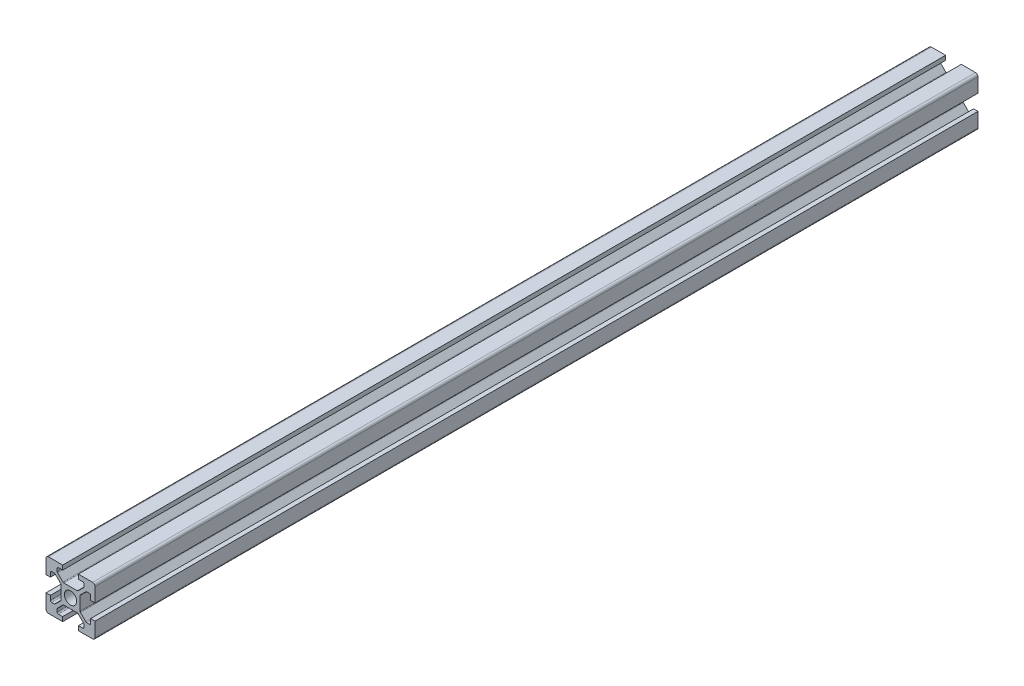
from build123d import *

# Parameters (mm, degrees)
SKETCH1_R           = 2.5
BOSS_EXTRUDE1_DEPTH = 360
FILLET1_R           = 1
FILLET2_R           = 0.5
FILLET3_R           = 0.5
FILLET4_R           = 0.5
FILLET5_R           = 0.5


with BuildPart() as part:
    # Sketch1 → Boss-Extrude1 (new body)
    with BuildSketch(Plane.XY):
        Polygon((13.2, 0), (13.2, 1.8), (15.45, 1.8), (15.45, 3.6), (12.95, 6.1), (7.05, 6.1), (4.55, 3.6), (4.55, 1.8), (6.8, 1.8), (6.8, 0), (0, 0), (0, 6.8), (1.8, 6.8), (1.8, 4.55), (3.6, 4.55), (6.1, 7.05), (6.1, 12.95), (3.6, 15.45), (1.8, 15.45), (1.8, 13.2), (0, 13.2), (0, 20), (6.8, 20), (6.8, 18.2), (4.55, 18.2), (4.55, 16.4), (7.05, 13.9), (12.95, 13.9), (15.45, 16.4), (15.45, 18.2), (13.2, 18.2), (13.2, 20), (20, 20), (20, 13.2), (18.2, 13.2), (18.2, 15.45), (16.4, 15.45), (13.9, 12.95), (13.9, 7.05), (16.4, 4.55), (18.2, 4.55), (18.2, 6.8), (20, 6.8), (20, 0), align=None)
        with Locations(Location((10, 10, 0), (0, 0, 180))):
            Circle(SKETCH1_R, mode=Mode.SUBTRACT)
    extrude(amount=BOSS_EXTRUDE1_DEPTH)

    # Fillet1
    fillet1_edges = [part.edges().sort_by_distance(p)[0] for p in [
        (0, 0, 180),
        (0, 20, 180),
        (20, 20, 180),
        (20, 0, 180),
    ]]
    fillet(fillet1_edges, radius=FILLET1_R)

    # Fillet2
    fillet2_edges = [part.edges().sort_by_distance(p)[0] for p in [
        (4.55, 18.2, 180),
        (4.55, 16.4, 180),
        (7.05, 13.9, 180),
        (12.95, 13.9, 180),
        (15.45, 16.4, 180),
        (15.45, 18.2, 180),
    ]]
    fillet(fillet2_edges, radius=FILLET2_R)

    # Fillet3
    fillet3_edges = [part.edges().sort_by_distance(p)[0] for p in [
        (18.2, 15.45, 180),
        (16.4, 15.45, 180),
        (13.9, 12.95, 180),
        (13.9, 7.05, 180),
        (16.4, 4.55, 180),
        (18.2, 4.55, 180),
    ]]
    fillet(fillet3_edges, radius=FILLET3_R)

    # Fillet4
    fillet4_edges = [part.edges().sort_by_distance(p)[0] for p in [
        (1.8, 4.55, 180),
        (3.6, 4.55, 180),
        (6.1, 7.05, 180),
        (6.1, 12.95, 180),
        (3.6, 15.45, 180),
        (1.8, 15.45, 180),
    ]]
    fillet(fillet4_edges, radius=FILLET4_R)

    # Fillet5
    fillet5_edges = [part.edges().sort_by_distance(p)[0] for p in [
        (15.45, 1.8, 180),
        (15.45, 3.6, 180),
        (12.95, 6.1, 180),
        (7.05, 6.1, 180),
        (4.55, 3.6, 180),
        (4.55, 1.8, 180),
    ]]
    fillet(fillet5_edges, radius=FILLET5_R)


solid = part.part
